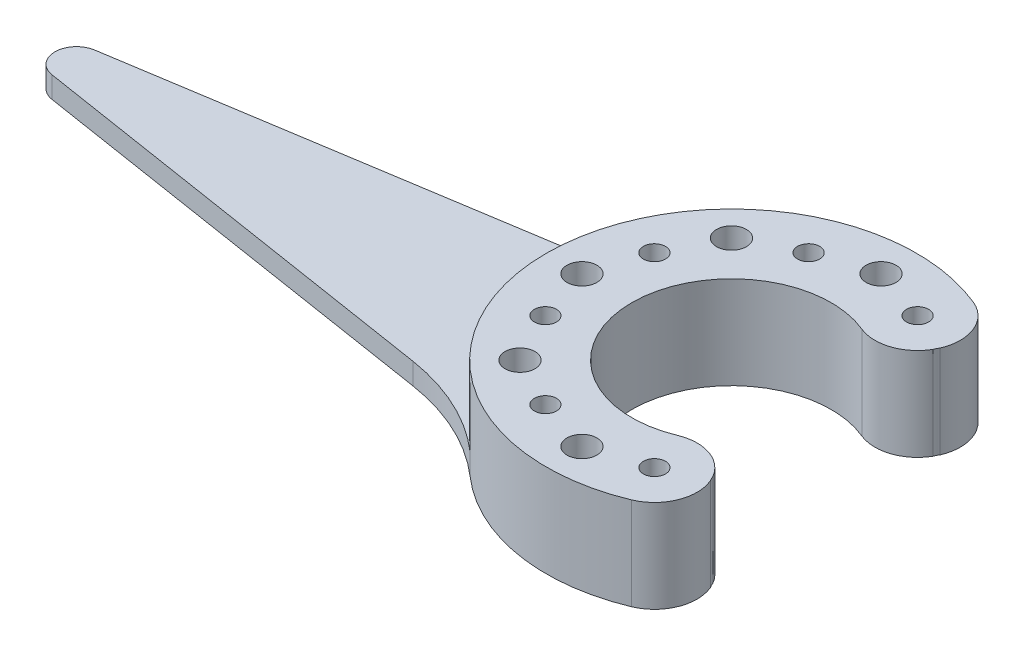
from build123d import *

# Parameters (mm, degrees)
SKETCH4_R           = 26
SKETCH4_R_2         = 2.1
SKETCH4_R_3         = 1.55
BOSS_EXTRUDE1_DEPTH = 13
SKETCH5_OUTSIDE_W   = 68.936
SKETCH5_OUTSIDE_H   = 68.936
CUT_EXTRUDE1_DEPTH  = 40
BOSS_EXTRUDE2_START = -3
BOSS_EXTRUDE2_DEPTH = 3


with BuildPart() as part:
    # Sketch4 → Boss-Extrude1 (new body)
    with BuildSketch(Plane(origin=(0, 0, 3), x_dir=(1, 0, 0), z_dir=(0, -1, 0))):
        with Locations(Location((0, -3, 0), (0, 0, 90))):
            Circle(SKETCH4_R)
        with Locations(Location((0, 18, 0), (0, 0, 90))):
            Circle(SKETCH4_R_2, mode=Mode.SUBTRACT)
        with Locations(Location((7.653668647, 15.47759065, 0), (0, 0, 90))):
            Circle(SKETCH4_R_3, mode=Mode.SUBTRACT)
        with Locations(Location((14.849242405, 11.849242405, 0), (0, 0, 90))):
            Circle(SKETCH4_R_2, mode=Mode.SUBTRACT)
        with Locations(Location((18.47759065, 4.653668647, 0), (0, 0, 90))):
            Circle(SKETCH4_R_3, mode=Mode.SUBTRACT)
        with Locations(Location((21, -3, 0), (0, 0, 90))):
            Circle(SKETCH4_R_2, mode=Mode.SUBTRACT)
        with Locations(Location((18.47759065, -10.653668647, 0), (0, 0, 90))):
            Circle(SKETCH4_R_3, mode=Mode.SUBTRACT)
        with Locations(Location((14.849242405, -17.849242405, 0), (0, 0, 90))):
            Circle(SKETCH4_R_2, mode=Mode.SUBTRACT)
        with Locations(Location((7.653668647, -21.47759065, 0), (0, 0, 90))):
            Circle(SKETCH4_R_3, mode=Mode.SUBTRACT)
        with Locations(Location((0, -24, 0), (0, 0, 90))):
            Circle(SKETCH4_R_2, mode=Mode.SUBTRACT)
        with Locations(Location((-7.653668647, -21.47759065, 0), (0, 0, 90))):
            Circle(SKETCH4_R_3, mode=Mode.SUBTRACT)
        with Locations(Location((-14.849242405, -17.849242405, 0), (0, 0, 90))):
            Circle(SKETCH4_R_2, mode=Mode.SUBTRACT)
        with Locations(Location((-18.47759065, -10.653668647, 0), (0, 0, 90))):
            Circle(SKETCH4_R_3, mode=Mode.SUBTRACT)
        with Locations(Location((-21, -3, 0), (0, 0, 90))):
            Circle(SKETCH4_R_2, mode=Mode.SUBTRACT)
        with Locations(Location((-18.47759065, 4.653668647, 0), (0, 0, 90))):
            Circle(SKETCH4_R_3, mode=Mode.SUBTRACT)
        with Locations(Location((-14.849242405, 11.849242405, 0), (0, 0, 90))):
            Circle(SKETCH4_R_2, mode=Mode.SUBTRACT)
        with Locations(Location((-7.653668647, 15.47759065, 0), (0, 0, 90))):
            Circle(SKETCH4_R_3, mode=Mode.SUBTRACT)
    extrude(amount=BOSS_EXTRUDE1_DEPTH)

    # Sketch5 outside → Cut-Extrude1 (cut, through all)
    with BuildSketch(Plane.XZ.offset(13)):
        Rectangle(SKETCH5_OUTSIDE_W, SKETCH5_OUTSIDE_H)
        with BuildLine():
            ThreePointArc((5.357568053, 12.934313455), (-14, 0), (5.357568053, -12.934313455))
            ThreePointArc((5.357568053, -12.934313455), (13.196945842, -16.181490056), (9.949769241, -24.020867845))
            ThreePointArc((9.949769241, -24.020867845), (-26, 0), (9.949769241, 24.020867845))
            ThreePointArc((9.949769241, 24.020867845), (13.196945842, 16.181490056), (5.357568053, 12.934313455))
        make_face(mode=Mode.SUBTRACT)
    extrude(amount=-CUT_EXTRUDE1_DEPTH, mode=Mode.SUBTRACT)

    # Sketch6 → Boss-Extrude2 (add)
    with BuildSketch(Plane.XZ.offset(13).offset(BOSS_EXTRUDE2_START)):
        with BuildLine():
            Line((-92.43614906, 3), (-32.213868088, 12.5))
            ThreePointArc((-32.213868088, 12.5), (-24.170350504, 14.962836151), (-17.126817214, 19.562007364))
            ThreePointArc((-17.126817214, 19.562007364), (-26, 0), (-17.126817214, -19.562007364))
            ThreePointArc((-17.126817214, -19.562007364), (-24.170350504, -14.962836151), (-32.213868088, -12.5))
            Line((-32.213868088, -12.5), (-92.43614906, -3))
            ThreePointArc((-92.43614906, -3), (-95, 0), (-92.43614906, 3))
        make_face()
    extrude(amount=BOSS_EXTRUDE2_DEPTH)


solid = part.part
